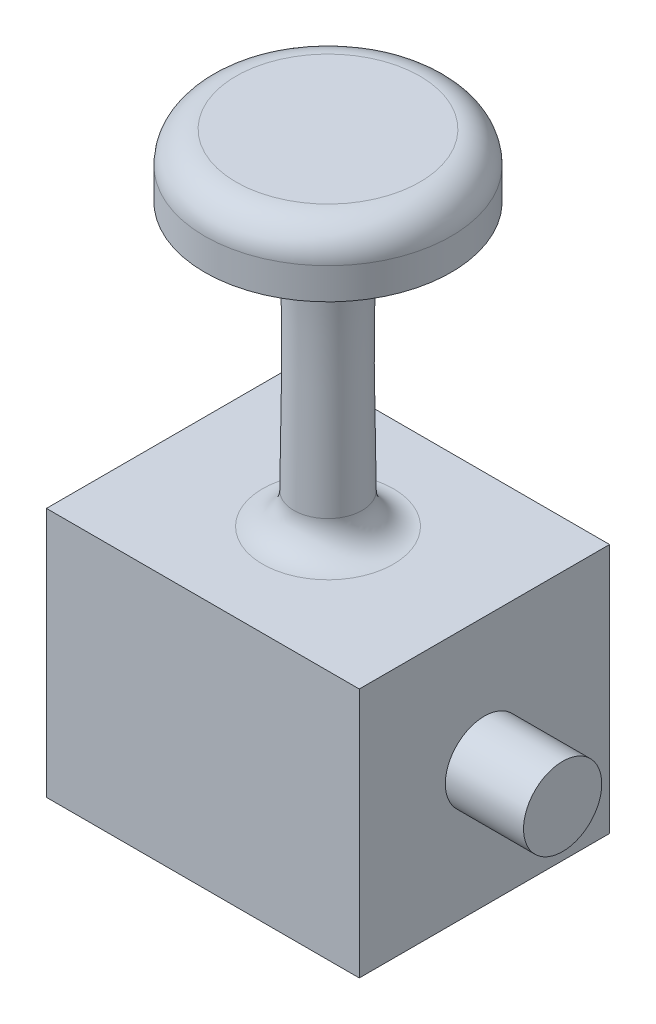
from build123d import *

# Parameters (mm, degrees)
SKETCH2_W          = 20.32
SKETCH2_H          = 20.32
CENTRAL_BOX_DEPTH  = 25.4
NIBBLES_DEPTH      = 6.35
NIBBLES_DEPTH_BACK = 31.75
SKETCH4_R          = 3.175
YAY_ROUNDED_R      = 2.54


with BuildPart() as part:
    # Sketch2 → central box (new body)
    with BuildSketch(Plane(origin=(0, 0, 0), x_dir=(0, 0, -1), z_dir=(1, 0, 0))):
        with Locations((10.16, 10.16)):
            Rectangle(SKETCH2_W, SKETCH2_H)
    extrude(amount=CENTRAL_BOX_DEPTH)

    # Sketch4 → nibbles (add, two sides: drawn at the far end of the back side and taken through both)
    with BuildSketch(Plane(origin=(25.4, 0, 0), x_dir=(0, 0, -1), z_dir=(1, 0, 0)).offset(-NIBBLES_DEPTH_BACK)):
        with Locations((10.16, 10.16)):
            Circle(SKETCH4_R)
    extrude(amount=NIBBLES_DEPTH + NIBBLES_DEPTH_BACK)

    # Sketch6 → stick (revolve)
    with BuildSketch(Plane.XY.offset(-10.16), mode=Mode.PRIVATE) as stick_sk:
        with BuildLine():
            Line((12.7, 20.32), (12.7, 48.26))
            Line((12.7, 48.26), (22.69993783, 48.26))
            Line((22.69993783, 48.26), (22.69993783, 43.18))
            add(Edge.make_bspline(
                [(22.69993783, 43.18), (14.011650276, 53.987913913), (15.389137078, 36.935795993), (15.494, 20.32)],
                knots=[0, 0, 0, 0, 1, 1, 1, 1], degree=3))
            Line((15.494, 20.32), (12.7, 20.32))
        make_face()
    revolve(stick_sk.sketch.rotate(Axis((12.7, 20.32, -10.16), (0, 1, 0)), 90), axis=Axis((12.7, 20.32, -10.16), (0, 1, 0)))

    # yay, rounded
    yay_rounded_edges = [part.edges().sort_by_distance(p)[0] for p in [
        (12.7, 20.32, -7.366),
        (12.7, 48.26, -0.16006217),
    ]]
    fillet(yay_rounded_edges, radius=YAY_ROUNDED_R)


solid = part.part
